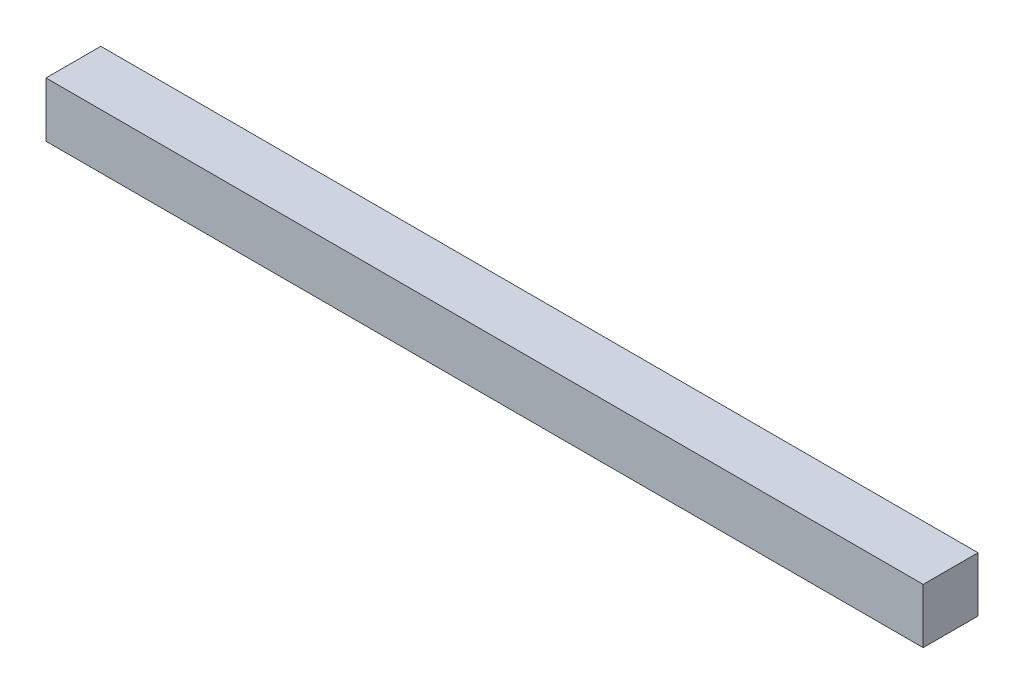
from build123d import *

# Parameters (mm, degrees)
SKETCH1_W           = 10
SKETCH1_H           = 10
BOSS_EXTRUDE1_DEPTH = 80


with BuildPart() as part:
    # Sketch1 → Boss-Extrude1 (new, symmetric)
    with BuildSketch(Plane(origin=(0, 0, 0), x_dir=(0, 0, -1), z_dir=(1, 0, 0))):
        Rectangle(SKETCH1_W, SKETCH1_H)
    extrude(amount=BOSS_EXTRUDE1_DEPTH, both=True)


solid = part.part
